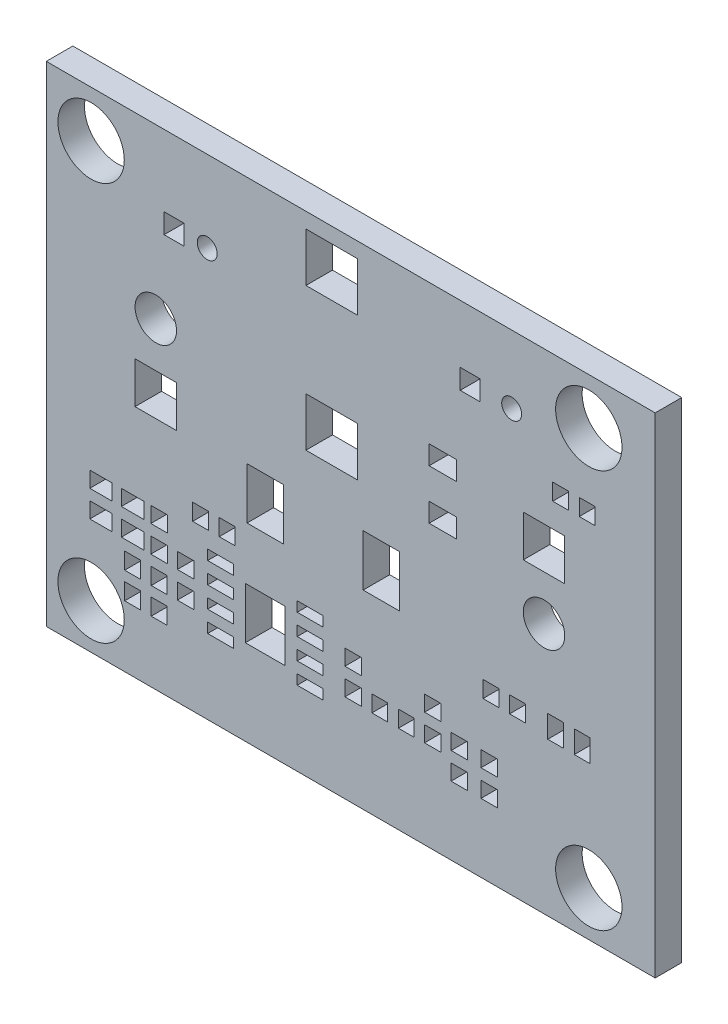
from build123d import *

# Parameters (mm, degrees)
ESQUISSE1_W        = 36.7
ESQUISSE1_H        = 29.5
ESQUISSE1_R        = 0.6
ESQUISSE1_R_2      = 1.25
ESQUISSE1_R_3      = 2
ESQUISSE1_W_2      = 0.95
ESQUISSE1_H_2      = 1.35
ESQUISSE1_W_3      = 1.65
ESQUISSE1_H_3      = 1.15
ESQUISSE1_W_4      = 1.2
ESQUISSE1_H_4      = 1.2
ESQUISSE1_H_5      = 1
ESQUISSE1_W_5      = 1
ESQUISSE1_H_6      = 0.95
ESQUISSE1_W_6      = 2.2
ESQUISSE1_H_7      = 3.1
ESQUISSE1_W_7      = 3.1
ESQUISSE1_H_8      = 2.95
ESQUISSE1_W_8      = 1.35
ESQUISSE1_W_9      = 2.5
ESQUISSE1_H_9      = 2.5
ESQUISSE1_W_10     = 1.5499
ESQUISSE1_H_10     = 0.5999
ESQUISSE1_W_11     = 2.4
BOSS_EXTRU_1_DEPTH = 1.6


with BuildPart() as part:
    # Esquisse1 → Boss.-Extru.1 (new body)
    with BuildSketch(Plane.XY):
        with Locations((15.65, -11.95)):
            Rectangle(ESQUISSE1_W, ESQUISSE1_H)
        with Locations((25.35, -1.3)):
            Circle(ESQUISSE1_R, mode=Mode.SUBTRACT)
        with Locations((7, -2.1)):
            Circle(ESQUISSE1_R, mode=Mode.SUBTRACT)
        with Locations((27.3, -11.56)):
            Circle(ESQUISSE1_R_2, mode=Mode.SUBTRACT)
        with Locations((3.9, -7.34)):
            Circle(ESQUISSE1_R_2, mode=Mode.SUBTRACT)
        with Locations((30, -24)):
            Circle(ESQUISSE1_R_3, mode=Mode.SUBTRACT)
        with Locations((0, -24)):
            Circle(ESQUISSE1_R_3, mode=Mode.SUBTRACT)
        with Locations((30, 0)):
            Circle(ESQUISSE1_R_3, mode=Mode.SUBTRACT)
        Circle(ESQUISSE1_R_3, mode=Mode.SUBTRACT)
        with Locations((28, -16.8)):
            Rectangle(ESQUISSE1_W_2, ESQUISSE1_H_2, mode=Mode.SUBTRACT)
        with Locations((29.6, -16.8)):
            Rectangle(ESQUISSE1_W_2, ESQUISSE1_H_2, mode=Mode.SUBTRACT)
        with Locations((21.2, -9.2)):
            Rectangle(ESQUISSE1_W_3, ESQUISSE1_H_3, mode=Mode.SUBTRACT)
        with Locations((21.2, -6.2)):
            Rectangle(ESQUISSE1_W_3, ESQUISSE1_H_3, mode=Mode.SUBTRACT)
        with Locations((22.85, -1.3)):
            Rectangle(ESQUISSE1_W_4, ESQUISSE1_H_4, mode=Mode.SUBTRACT)
        with Locations((24.1, -16.8)):
            Rectangle(ESQUISSE1_W_2, ESQUISSE1_H_5, mode=Mode.SUBTRACT)
        with Locations((25.7, -16.8)):
            Rectangle(ESQUISSE1_W_2, ESQUISSE1_H_5, mode=Mode.SUBTRACT)
        with Locations((24, -22.1)):
            Rectangle(ESQUISSE1_W_5, ESQUISSE1_H_6, mode=Mode.SUBTRACT)
        with Locations((24, -20.5)):
            Rectangle(ESQUISSE1_W_5, ESQUISSE1_H_6, mode=Mode.SUBTRACT)
        with Locations((22.2, -20.5)):
            Rectangle(ESQUISSE1_W_5, ESQUISSE1_H_6, mode=Mode.SUBTRACT)
        with Locations((22.2, -22.1)):
            Rectangle(ESQUISSE1_W_5, ESQUISSE1_H_6, mode=Mode.SUBTRACT)
        with Locations((15.8, -19.3)):
            Rectangle(ESQUISSE1_W_5, ESQUISSE1_H_6, mode=Mode.SUBTRACT)
        with Locations((15.8, -20.9)):
            Rectangle(ESQUISSE1_W_5, ESQUISSE1_H_6, mode=Mode.SUBTRACT)
        with Locations((20.6, -19.3)):
            Rectangle(ESQUISSE1_W_5, ESQUISSE1_H_6, mode=Mode.SUBTRACT)
        with Locations((20.6, -20.9)):
            Rectangle(ESQUISSE1_W_5, ESQUISSE1_H_6, mode=Mode.SUBTRACT)
        with Locations((17.4, -20.9)):
            Rectangle(ESQUISSE1_W_2, ESQUISSE1_H_5, mode=Mode.SUBTRACT)
        with Locations((19, -20.9)):
            Rectangle(ESQUISSE1_W_2, ESQUISSE1_H_5, mode=Mode.SUBTRACT)
        with Locations((4.1, -22.5)):
            Rectangle(ESQUISSE1_W_2, ESQUISSE1_H_5, mode=Mode.SUBTRACT)
        with Locations((2.5, -22.5)):
            Rectangle(ESQUISSE1_W_2, ESQUISSE1_H_5, mode=Mode.SUBTRACT)
        with Locations((4.1, -20.9)):
            Rectangle(ESQUISSE1_W_2, ESQUISSE1_H_5, mode=Mode.SUBTRACT)
        with Locations((2.5, -20.9)):
            Rectangle(ESQUISSE1_W_2, ESQUISSE1_H_5, mode=Mode.SUBTRACT)
        with Locations((5.7, -19.3)):
            Rectangle(ESQUISSE1_W_5, ESQUISSE1_H_6, mode=Mode.SUBTRACT)
        with Locations((5.7, -20.9)):
            Rectangle(ESQUISSE1_W_5, ESQUISSE1_H_6, mode=Mode.SUBTRACT)
        with Locations((29.9, -4.4)):
            Rectangle(ESQUISSE1_W_2, ESQUISSE1_H_5, mode=Mode.SUBTRACT)
        with Locations((28.3, -4.4)):
            Rectangle(ESQUISSE1_W_2, ESQUISSE1_H_5, mode=Mode.SUBTRACT)
        with Locations((4.1, -17.7)):
            Rectangle(ESQUISSE1_W_5, ESQUISSE1_H_6, mode=Mode.SUBTRACT)
        with Locations((4.1, -19.3)):
            Rectangle(ESQUISSE1_W_5, ESQUISSE1_H_6, mode=Mode.SUBTRACT)
        with Locations((8.2, -16.3)):
            Rectangle(ESQUISSE1_W_2, ESQUISSE1_H_5, mode=Mode.SUBTRACT)
        with Locations((6.6, -16.3)):
            Rectangle(ESQUISSE1_W_2, ESQUISSE1_H_5, mode=Mode.SUBTRACT)
        with Locations((17.5, -13.7)):
            Rectangle(ESQUISSE1_W_6, ESQUISSE1_H_7, mode=Mode.SUBTRACT)
        with Locations((10.5, -13.7)):
            Rectangle(ESQUISSE1_W_6, ESQUISSE1_H_7, mode=Mode.SUBTRACT)
        with Locations((14.5, -8.2)):
            Rectangle(ESQUISSE1_W_7, ESQUISSE1_H_8, mode=Mode.SUBTRACT)
        with Locations((14.5, 0.4)):
            Rectangle(ESQUISSE1_W_7, ESQUISSE1_H_8, mode=Mode.SUBTRACT)
        with Locations((2.5, -17.7)):
            Rectangle(ESQUISSE1_W_8, ESQUISSE1_H_6, mode=Mode.SUBTRACT)
        with Locations((2.5, -19.3)):
            Rectangle(ESQUISSE1_W_8, ESQUISSE1_H_6, mode=Mode.SUBTRACT)
        with Locations((0.6, -17.7)):
            Rectangle(ESQUISSE1_W_8, ESQUISSE1_H_6, mode=Mode.SUBTRACT)
        with Locations((0.6, -19.3)):
            Rectangle(ESQUISSE1_W_8, ESQUISSE1_H_6, mode=Mode.SUBTRACT)
        with Locations((5, -2.1)):
            Rectangle(ESQUISSE1_W_4, ESQUISSE1_H_4, mode=Mode.SUBTRACT)
        with Locations((27.3, -7.6)):
            Rectangle(ESQUISSE1_W_9, ESQUISSE1_H_9, mode=Mode.SUBTRACT)
        with Locations((3.9, -11.3)):
            Rectangle(ESQUISSE1_W_9, ESQUISSE1_H_9, mode=Mode.SUBTRACT)
        with Locations((7.79995, -18.09505)):
            Rectangle(ESQUISSE1_W_10, ESQUISSE1_H_10, mode=Mode.SUBTRACT)
        with Locations((7.79995, -19.36505)):
            Rectangle(ESQUISSE1_W_10, ESQUISSE1_H_10, mode=Mode.SUBTRACT)
        with Locations((7.79995, -20.63505)):
            Rectangle(ESQUISSE1_W_10, ESQUISSE1_H_10, mode=Mode.SUBTRACT)
        with Locations((7.79995, -21.90505)):
            Rectangle(ESQUISSE1_W_10, ESQUISSE1_H_10, mode=Mode.SUBTRACT)
        with Locations((13.19995, -21.90505)):
            Rectangle(ESQUISSE1_W_10, ESQUISSE1_H_10, mode=Mode.SUBTRACT)
        with Locations((13.19995, -20.63505)):
            Rectangle(ESQUISSE1_W_10, ESQUISSE1_H_10, mode=Mode.SUBTRACT)
        with Locations((13.19995, -19.36505)):
            Rectangle(ESQUISSE1_W_10, ESQUISSE1_H_10, mode=Mode.SUBTRACT)
        with Locations((13.19995, -18.09505)):
            Rectangle(ESQUISSE1_W_10, ESQUISSE1_H_10, mode=Mode.SUBTRACT)
        with Locations((10.5, -20)):
            Rectangle(ESQUISSE1_W_11, ESQUISSE1_H_7, mode=Mode.SUBTRACT)
    extrude(amount=BOSS_EXTRU_1_DEPTH)


solid = part.part
